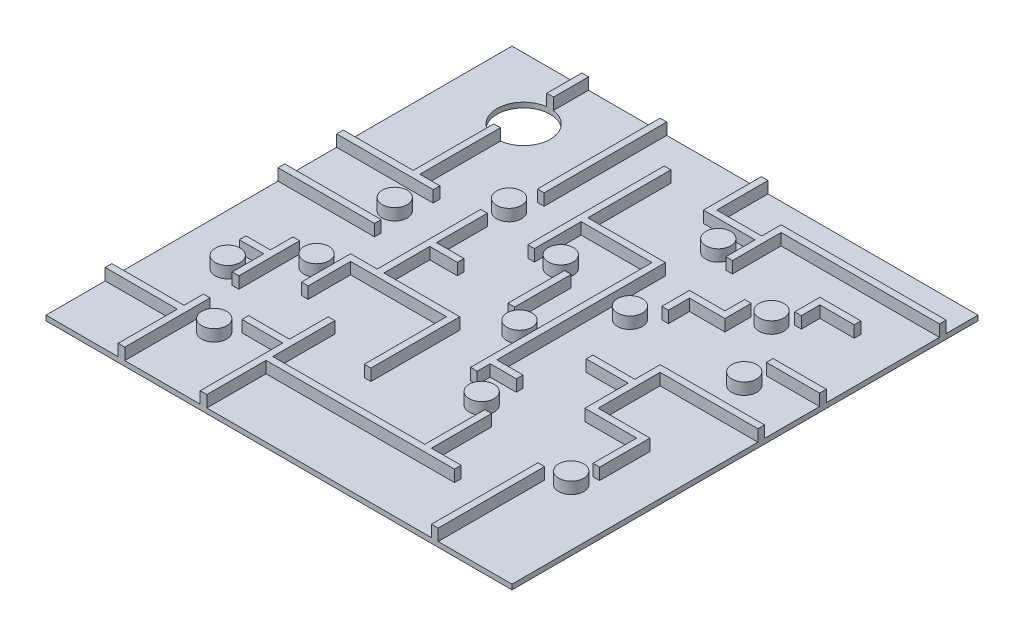
from build123d import *
from build123d.topology import SkipClean

# Parameters (mm, degrees)
SKETCH1_W           = 280
SKETCH1_H           = 280
SKETCH1_R           = 16
BOSS_EXTRUDE1_DEPTH = 1.5
SKETCH2_R           = 7.5
SKETCH2_W           = 4
SKETCH2_H           = 73.713198053
SKETCH2_W_2         = 58
SKETCH2_H_2         = 4
SKETCH2_H_3         = 64
SKETCH2_W_3         = 32
SKETCH2_H_4         = 34
BOSS_EXTRUDE2_DEPTH = 7


with BuildPart() as part:
    # Sketch1 → Boss-Extrude1 (new, symmetric)
    with BuildSketch(Plane(origin=(0, 0, 0), x_dir=(1, 0, 0), z_dir=(0, 1, 0))):
        Rectangle(SKETCH1_W, SKETCH1_H)
        with Locations(Location((-96, 103, 0), (0, 0, 270))):
            Circle(SKETCH1_R, mode=Mode.SUBTRACT)
    extrude(amount=BOSS_EXTRUDE1_DEPTH, both=True)

    # Sketch2 → Boss-Extrude2 (add)
    with SkipClean():  # the faces are left unmerged after this step: merging them gives an invalid solid
        with BuildSketch(Plane(origin=(0, 1.5, 0), x_dir=(1, 0, 0), z_dir=(0, 1, 0))):
            with Locations(Location((-54.759044634, 52.982810669, 0), (0, 0, 270))):
                Circle(SKETCH2_R)
            with Locations(Location((-89.473504534, 19.023832923, 0), (0, 0, 270))):
                Circle(SKETCH2_R)
            with Locations(Location((-83.738928303, -33.690548853, 0), (0, 0, 270))):
                Circle(SKETCH2_R)
            with Locations(Location((-109.516269096, -61.269929812, 0), (0, 0, 270))):
                Circle(SKETCH2_R)
            with Locations(Location((-80.69273369, -98.230062392, 0), (0, 0, 270))):
                Circle(SKETCH2_R)
            with Locations(Location((37.587423323, -55.831973409, 0), (0, 0, 270))):
                Circle(SKETCH2_R)
            with Locations(Location((105.9104653, -70.333190482, 0), (0, 0, 270))):
                Circle(SKETCH2_R)
            with Locations(Location((11.819316554, -7.352500668, 0), (0, 0, 270))):
                Circle(SKETCH2_R)
            with Locations(Location((-9.755931913, 39.066973306, 0), (0, 0, 270))):
                Circle(SKETCH2_R)
            with Locations(Location((29.170109307, 94.80128466, 0), (0, 0, 270))):
                Circle(SKETCH2_R)
            with Locations(Location((82.624857116, 73.284632448, 0), (0, 0, 270))):
                Circle(SKETCH2_R)
            with Locations(Location((37.587423323, 33.266850719, 0), (0, 0, 270))):
                Circle(SKETCH2_R)
            with Locations(Location((106.252694304, 33.287862382, 0), (0, 0, 270))):
                Circle(SKETCH2_R)
            with Locations((-49, 103.143400974)):
                Rectangle(SKETCH2_W, SKETCH2_H)
            with BuildLine():
                Line((-94, 140), (-98, 140))
                Line((-98, 140), (-98, 118.874507866))
                ThreePointArc((-98, 118.874507866), (-96, 119), (-94, 118.874507866))
                Line((-94, 118.874507866), (-94, 140))
            make_face()
            with BuildLine():
                Line((-140, 38.624379655), (-98, 38.624379655))
                Line((-98, 38.624379655), (-98, 87.125492134))
                ThreePointArc((-98, 87.125492134), (-96, 87), (-94, 87.125492134))
                Line((-94, 87.125492134), (-94, 38.624379655))
                Line((-94, 38.624379655), (-82, 38.624379655))
                Line((-82, 38.624379655), (-82, 34.624379655))
                Line((-82, 34.624379655), (-140, 34.624379655))
                Line((-140, 34.624379655), (-140, 38.624379655))
            make_face()
            Polygon((-140, -100.418377476), (-96.668523278, -100.418377476), (-96.668523278, -88.738640334), (-92.668523278, -88.738640334), (-92.668523278, -140), (-96.668523278, -140), (-96.668523278, -104.418377476), (-140, -104.418377476), align=None)
            with Locations((-111, 1.423286191)):
                Rectangle(SKETCH2_W_2, SKETCH2_H_2)
            Polygon((-47.345115434, -140), (-47.345115434, -90.364557891), (-71.881878867, -90.364557891), (-71.881878867, -86.364557891), (-47.345115434, -86.364557891), (-47.345115434, -63.088559208), (-43.345115434, -63.088559208), (-43.345115434, -100.418377476), (48.027751829, -100.418377476), (48.027751829, -64.371939455), (52.027751829, -64.371939455), (52.027751829, -100.418377476), (69.827851451, -100.418377476), (69.827851451, -104.418377476), (-43.345115434, -104.418377476), (-43.345115434, -140), align=None)
            Polygon((140, 7.737266613), (81.293142587, 7.737266613), (81.293142587, -29.543544834), (112.431248518, -29.543544834), (112.431248518, -59.777272974), (108.431248518, -59.777272974), (108.431248518, -33.543544834), (77.293142587, -33.543544834), (77.293142587, -7.47679166), (52.027751829, -7.47679166), (52.027751829, -3.47679166), (77.293142587, -3.47679166), (77.293142587, 11.737266613), (140, 11.737266613), align=None)
            with Locations((93.622601552, -108)):
                Rectangle(SKETCH2_W, SKETCH2_H_3)
            Polygon((-99.510735812, -32.111868954), (-95.510735812, -32.111868954), (-95.510735812, -68.594238703), (-99.510735812, -68.594238703), (-99.510735812, -49.675826938), (-114.127069846, -49.675826938), (-114.127069846, -45.675826938), (-99.510735812, -45.675826938), align=None)
            with Locations((124, 46.843999527)):
                Rectangle(SKETCH2_W_3, SKETCH2_H_2)
            Polygon((-73.435195895, -53.042459291), (-69.435195895, -53.042459291), (-69.435195895, -27.528186601), (-11.837088751, -27.528186601), (-11.837088751, -76.919702569), (-7.837088751, -76.919702569), (-7.837088751, -23.528186601), (-53.440050937, -23.528186601), (-53.440050937, 4.043094912), (-36.882667743, 4.043094912), (-36.882667743, 8.043094912), (-53.440050937, 8.043094912), (-53.440050937, 38.63118777), (-57.440050937, 38.63118777), (-57.440050937, -23.528186601), (-73.435195895, -23.528186601), align=None)
            Polygon((114.833141636, 94.80128466), (114.833141636, 90.80128466), (94.203549623, 90.80128466), (94.203549623, 79.625492134), (90.203549623, 79.625492134), (90.203549623, 94.80128466), align=None)
            with Locations((1.57904958, 15.009472223)):
                Rectangle(SKETCH2_W, SKETCH2_H_4)
            Polygon((68.742119222, 71), (68.742119222, 59.19860167), (47.447056499, 59.19860167), (47.447056499, 42.554658178), (51.447056499, 42.554658178), (51.447056499, 55.19860167), (72.742119222, 55.19860167), (72.742119222, 71), align=None)
            Polygon((21.727135977, -46.6315684), (25.727135977, -46.6315684), (25.727135977, -38.844500644), (41.459511743, -38.844500644), (41.459511743, -34.844500644), (25.727135977, -34.844500644), (25.727135977, 66.420221849), (-20.87255933, 66.420221849), (-20.87255933, 116.344219933), (-24.87255933, 116.344219933), (-24.87255933, 34.358038326), (-20.87255933, 34.358038326), (-20.87255933, 62.420221849), (21.727135977, 62.420221849), align=None)
            Polygon((140, 116.845058218), (44.841725693, 116.845058218), (44.841725693, 87.65657302), (40.841725693, 87.65657302), (40.841725693, 105.182034885), (9.848778982, 105.182034885), (9.848778982, 140), (13.848778982, 140), (13.848778982, 109.182034885), (40.841725693, 109.182034885), (40.841725693, 120.845058218), (140, 120.845058218), align=None)
        extrude(amount=BOSS_EXTRUDE2_DEPTH)


solid = part.part
